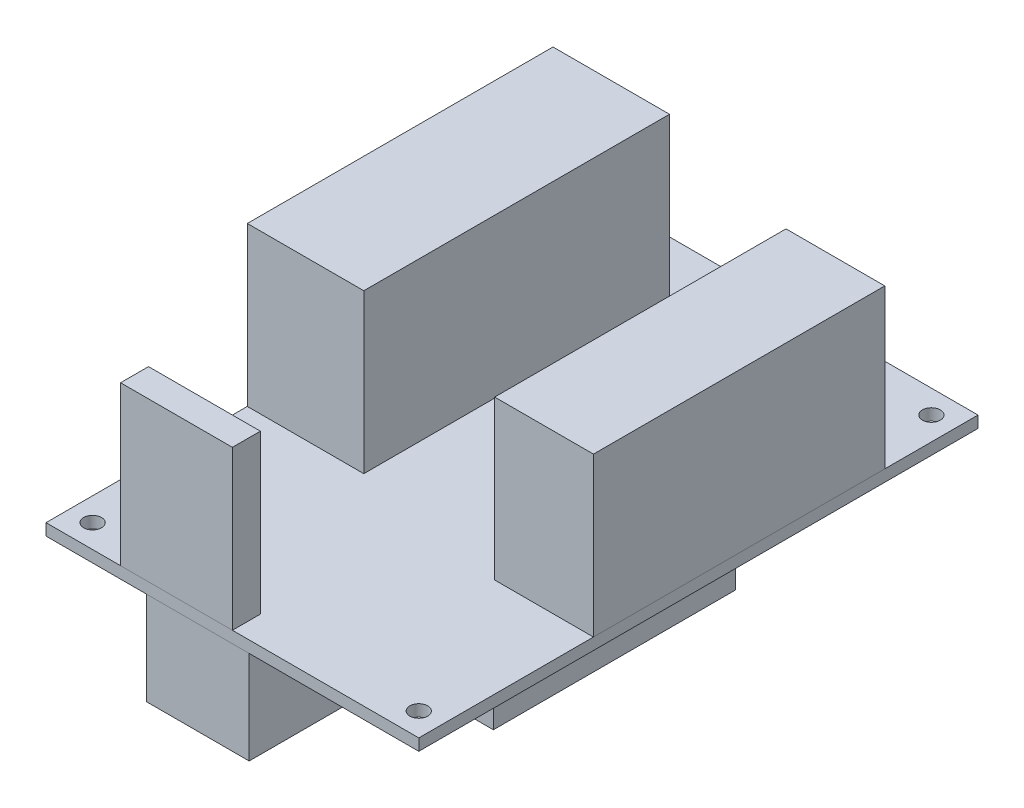
from build123d import *

# Parameters (mm, degrees)
SKETCH1_W             = 50.8
SKETCH1_H             = 76.2
SKETCH1_R             = 1.2192
BOSS_EXTRUDE1_DEPTH   = 1.5875
SKETCH2_W             = 15.875
SKETCH2_H             = 41.656
BOSS_EXTRUDE2_DEPTH   = 21.59
SKETCH2_W_2           = 13.462
SKETCH2_H_2           = 39.7002
BOSS_EXTRUDE2_2_DEPTH = 21.59
SKETCH2_W_3           = 15.24
SKETCH2_H_3           = 3.81
BOSS_EXTRUDE2_3_DEPTH = 21.59
SKETCH3_W             = 13.97
SKETCH3_H             = 60.198
BOSS_EXTRUDE3_DEPTH   = 12.7
SKETCH3_W_2           = 12.7
SKETCH3_H_2           = 33.02
BOSS_EXTRUDE3_2_DEPTH = 12.7


with BuildPart() as part:
    # Sketch1 → Boss-Extrude1 (new body)
    with BuildSketch(Plane(origin=(0, 0, 0), x_dir=(1, 0, 0), z_dir=(0, 1, 0))):
        Rectangle(SKETCH1_W, SKETCH1_H)
        with Locations(Location((-22.225, 34.925, 0), (0, 0, 270))):
            Circle(SKETCH1_R, mode=Mode.SUBTRACT)
        with Locations(Location((22.225, 34.925, 0), (0, 0, 270))):
            Circle(SKETCH1_R, mode=Mode.SUBTRACT)
        with Locations(Location((-22.225, -34.925, 0), (0, 0, 270))):
            Circle(SKETCH1_R, mode=Mode.SUBTRACT)
        with Locations(Location((22.225, -34.925, 0), (0, 0, 270))):
            Circle(SKETCH1_R, mode=Mode.SUBTRACT)
    extrude(amount=BOSS_EXTRUDE1_DEPTH)


with BuildPart() as body_2:
    # Sketch2 → Boss-Extrude2 (new body)
    with BuildSketch(Plane(origin=(0, 1.5875, 0), x_dir=(1, 0, 0), z_dir=(0, 1, 0))):
        with Locations((-17.4625, 10.16)):
            Rectangle(SKETCH2_W, SKETCH2_H)
    extrude(amount=BOSS_EXTRUDE2_DEPTH)


with BuildPart() as body_3:
    # Sketch2 → Boss-Extrude2 2 (new body)
    with BuildSketch(Plane(origin=(0, 1.5875, 0), x_dir=(1, 0, 0), z_dir=(0, 1, 0))):
        with Locations((18.669, 5.5499)):
            Rectangle(SKETCH2_W_2, SKETCH2_H_2)
    extrude(amount=BOSS_EXTRUDE2_2_DEPTH)


with BuildPart() as body_4:
    # Sketch2 → Boss-Extrude2 3 (new body)
    with BuildSketch(Plane(origin=(0, 1.5875, 0), x_dir=(1, 0, 0), z_dir=(0, 1, 0))):
        with Locations((-7.62, -36.195)):
            Rectangle(SKETCH2_W_3, SKETCH2_H_3)
    extrude(amount=BOSS_EXTRUDE2_3_DEPTH)


with BuildPart() as body_5:
    # Sketch3 → Boss-Extrude3 (new body)
    with BuildSketch(Plane.XZ):
        with Locations((-4.699, 8.001)):
            Rectangle(SKETCH3_W, SKETCH3_H)
    extrude(amount=BOSS_EXTRUDE3_DEPTH)


with BuildPart() as body_6:
    # Sketch3 → Boss-Extrude3 2 (new body)
    with BuildSketch(Plane.XZ):
        with Locations((8.89, 1.27)):
            Rectangle(SKETCH3_W_2, SKETCH3_H_2)
    extrude(amount=BOSS_EXTRUDE3_2_DEPTH)


solid = Compound([part.part, body_2.part, body_3.part, body_4.part, body_5.part, body_6.part])
